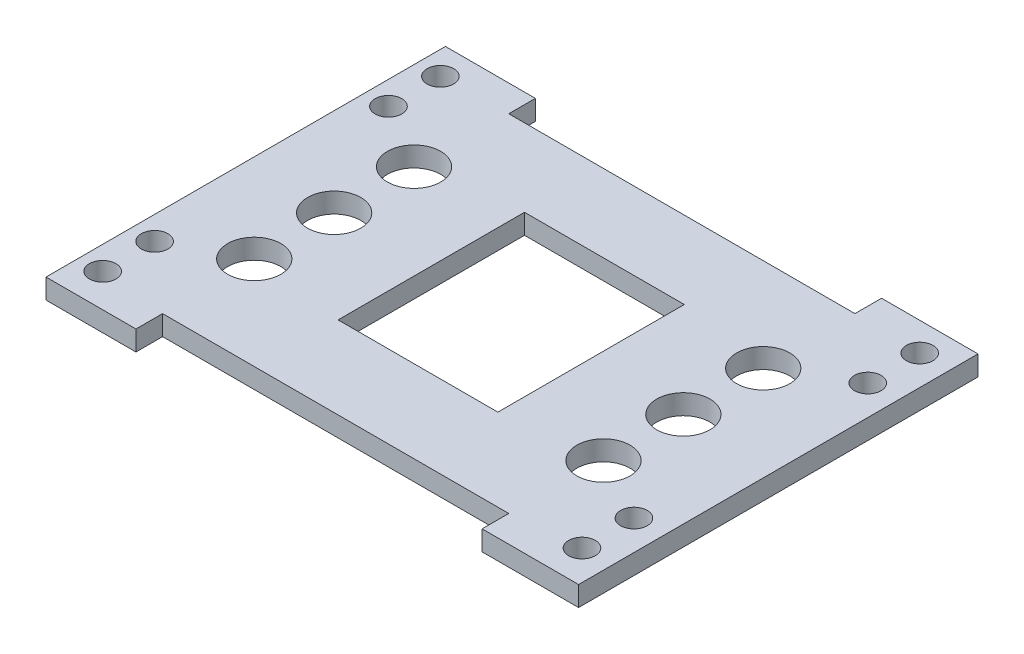
from build123d import *

# Parameters (mm, degrees)
TOP_PLATE_2_SKETCH_R   = 1
TOP_PLATE_2_SKETCH_R_2 = 2
TOP_PLATE_2_SKETCH_W   = 12
TOP_PLATE_2_SKETCH_H   = 14
TOP_PLATE_2_DEPTH      = 1.5


with BuildPart() as part:
    # Top Plate 2 Sketch → Top Plate 2 (new body)
    with BuildSketch(Plane(origin=(0, 0, 0), x_dir=(1, 0, 0), z_dir=(0, 1, 0))):
        Polygon((-13, 14.817316164), (-19.756421551, 14.817316164), (-19.756421551, -15.182683836), (-13, -15.182683836), (-13, -13.182683836), (13, -13.182683836), (13, -15.182683836), (20.243578449, -15.182683836), (20.243578449, 14.817316164), (13, 14.817316164), (13, 12.817316164), (-13, 12.817316164), align=None)
        with Locations(Location((-18, -12.682683836, 0), (0, 0, 270))):
            Circle(TOP_PLATE_2_SKETCH_R, mode=Mode.SUBTRACT)
        with Locations(Location((-18, -8.782683836, 0), (0, 0, 270))):
            Circle(TOP_PLATE_2_SKETCH_R, mode=Mode.SUBTRACT)
        with Locations(Location((-13.113273082, -6.182683836, 0), (0, 0, 270))):
            Circle(TOP_PLATE_2_SKETCH_R_2, mode=Mode.SUBTRACT)
        with Locations(Location((18, -12.682683836, 0), (0, 0, 270))):
            Circle(TOP_PLATE_2_SKETCH_R, mode=Mode.SUBTRACT)
        with Locations(Location((18, -8.782683836, 0), (0, 0, 270))):
            Circle(TOP_PLATE_2_SKETCH_R, mode=Mode.SUBTRACT)
        with Locations(Location((13.113273082, -6.182683836, 0), (0, 0, 270))):
            Circle(TOP_PLATE_2_SKETCH_R_2, mode=Mode.SUBTRACT)
        with Locations(Location((-13.113273082, -0.182683836, 0), (0, 0, 270))):
            Circle(TOP_PLATE_2_SKETCH_R_2, mode=Mode.SUBTRACT)
        with Locations(Location((-13.113273082, 5.817316164, 0), (0, 0, 270))):
            Circle(TOP_PLATE_2_SKETCH_R_2, mode=Mode.SUBTRACT)
        Rectangle(TOP_PLATE_2_SKETCH_W, TOP_PLATE_2_SKETCH_H, mode=Mode.SUBTRACT)
        with Locations(Location((-18, 8.782683836, 0), (0, 0, 270))):
            Circle(TOP_PLATE_2_SKETCH_R, mode=Mode.SUBTRACT)
        with Locations(Location((-18, 12.682683836, 0), (0, 0, 270))):
            Circle(TOP_PLATE_2_SKETCH_R, mode=Mode.SUBTRACT)
        with Locations(Location((13.113273082, -0.182683836, 0), (0, 0, 270))):
            Circle(TOP_PLATE_2_SKETCH_R_2, mode=Mode.SUBTRACT)
        with Locations(Location((13.113273082, 5.817316164, 0), (0, 0, 270))):
            Circle(TOP_PLATE_2_SKETCH_R_2, mode=Mode.SUBTRACT)
        with Locations(Location((18, 8.782683836, 0), (0, 0, 270))):
            Circle(TOP_PLATE_2_SKETCH_R, mode=Mode.SUBTRACT)
        with Locations(Location((18, 12.682683836, 0), (0, 0, 270))):
            Circle(TOP_PLATE_2_SKETCH_R, mode=Mode.SUBTRACT)
    extrude(amount=TOP_PLATE_2_DEPTH)


solid = part.part
